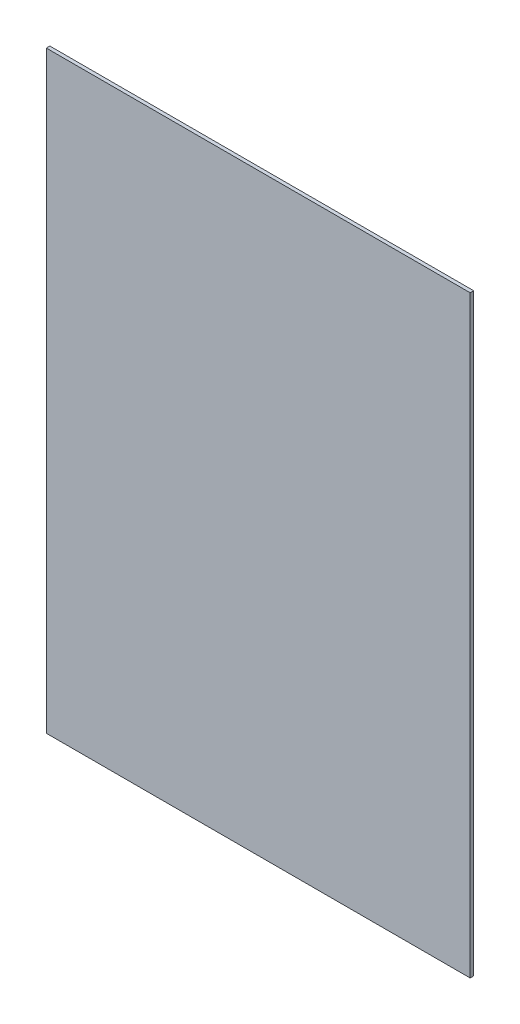
from build123d import *

# Parameters (mm, degrees)
SKETCH1_W           = 381
SKETCH1_H           = 533.4
BOSS_EXTRUDE1_DEPTH = 3.175


with BuildPart() as part:
    # Sketch1 → Boss-Extrude1 (new body)
    with BuildSketch(Plane.XY):
        with Locations((190.5, 266.7)):
            Rectangle(SKETCH1_W, SKETCH1_H)
    extrude(amount=BOSS_EXTRUDE1_DEPTH)


solid = part.part
